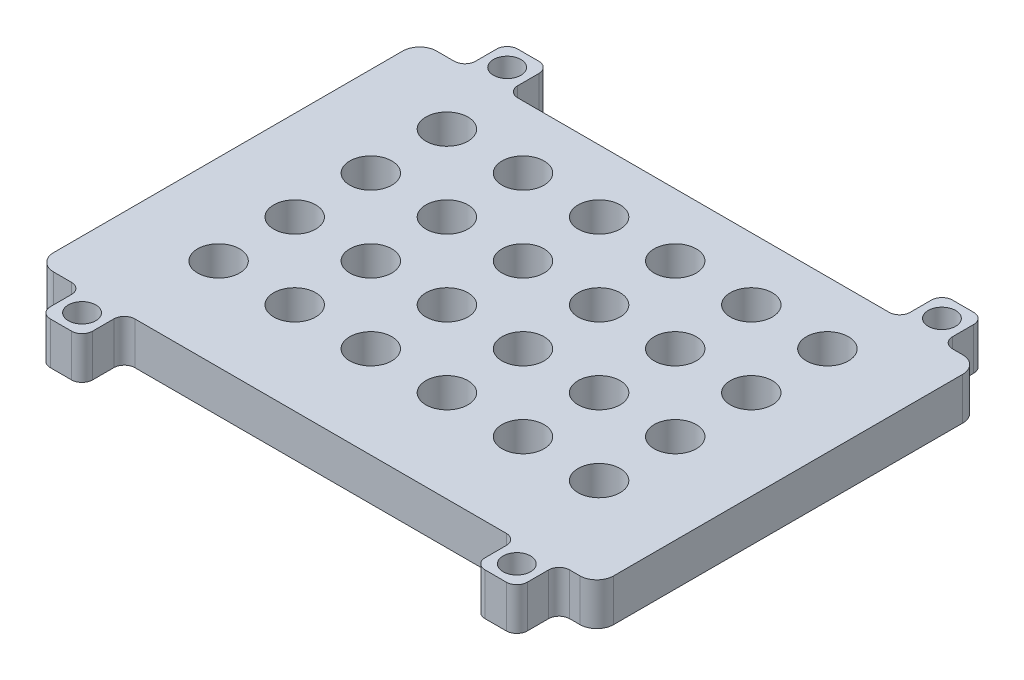
from build123d import *

# Parameters (mm, degrees)
SKETCH1_W           = 132.45
SKETCH1_H           = 90.551
SKETCH1_R           = 3.5
BOSS_EXTRUDE1_DEPTH = 10
SKETCH3_W           = 10
SKETCH3_H           = 10
BOSS_EXTRUDE3_DEPTH = 10
SKETCH4_R           = 3.25
CUT_EXTRUDE2_DEPTH  = 87.839688652
FILLET2_R           = 2.5
FILLET3_R           = 4
SKETCH5_R           = 4.975
CUT_EXTRUDE3_DEPTH  = 9.5


with BuildPart() as part:
    # Sketch1 → Boss-Extrude1 (new body)
    with BuildSketch(Plane(origin=(0, 0, 0), x_dir=(1, 0, 0), z_dir=(0, 1, 0))):
        Rectangle(SKETCH1_W, SKETCH1_H)
        with Locations(Location((-45, 30.5, 0), (0, 0, 270))):
            Circle(SKETCH1_R, mode=Mode.SUBTRACT)
        with Locations(Location((-27, 30.5, 0), (0, 0, 270))):
            Circle(SKETCH1_R, mode=Mode.SUBTRACT)
        with Locations(Location((-9, 30.5, 0), (0, 0, 270))):
            Circle(SKETCH1_R, mode=Mode.SUBTRACT)
        with Locations(Location((9, 30.5, 0), (0, 0, 270))):
            Circle(SKETCH1_R, mode=Mode.SUBTRACT)
        with Locations(Location((27, 30.5, 0), (0, 0, 270))):
            Circle(SKETCH1_R, mode=Mode.SUBTRACT)
        with Locations(Location((45, 30.5, 0), (0, 0, 270))):
            Circle(SKETCH1_R, mode=Mode.SUBTRACT)
        with Locations(Location((-27, 12.5, 0), (0, 0, 270))):
            Circle(SKETCH1_R, mode=Mode.SUBTRACT)
        with Locations(Location((-9, 12.5, 0), (0, 0, 270))):
            Circle(SKETCH1_R, mode=Mode.SUBTRACT)
        with Locations(Location((9, 12.5, 0), (0, 0, 270))):
            Circle(SKETCH1_R, mode=Mode.SUBTRACT)
        with Locations(Location((27, 12.5, 0), (0, 0, 270))):
            Circle(SKETCH1_R, mode=Mode.SUBTRACT)
        with Locations(Location((45, 12.5, 0), (0, 0, 270))):
            Circle(SKETCH1_R, mode=Mode.SUBTRACT)
        with Locations(Location((-27, -5.5, 0), (0, 0, 270))):
            Circle(SKETCH1_R, mode=Mode.SUBTRACT)
        with Locations(Location((-9, -5.5, 0), (0, 0, 270))):
            Circle(SKETCH1_R, mode=Mode.SUBTRACT)
        with Locations(Location((9, -5.5, 0), (0, 0, 270))):
            Circle(SKETCH1_R, mode=Mode.SUBTRACT)
        with Locations(Location((27, -5.5, 0), (0, 0, 270))):
            Circle(SKETCH1_R, mode=Mode.SUBTRACT)
        with Locations(Location((45, -5.5, 0), (0, 0, 270))):
            Circle(SKETCH1_R, mode=Mode.SUBTRACT)
        with Locations(Location((-27, -23.5, 0), (0, 0, 270))):
            Circle(SKETCH1_R, mode=Mode.SUBTRACT)
        with Locations(Location((-9, -23.5, 0), (0, 0, 270))):
            Circle(SKETCH1_R, mode=Mode.SUBTRACT)
        with Locations(Location((9, -23.5, 0), (0, 0, 270))):
            Circle(SKETCH1_R, mode=Mode.SUBTRACT)
        with Locations(Location((27, -23.5, 0), (0, 0, 270))):
            Circle(SKETCH1_R, mode=Mode.SUBTRACT)
        with Locations(Location((45, -23.5, 0), (0, 0, 270))):
            Circle(SKETCH1_R, mode=Mode.SUBTRACT)
        with Locations(Location((-45, 12.5, 0), (0, 0, 270))):
            Circle(SKETCH1_R, mode=Mode.SUBTRACT)
        with Locations(Location((-45, -5.5, 0), (0, 0, 270))):
            Circle(SKETCH1_R, mode=Mode.SUBTRACT)
        with Locations(Location((-45, -23.5, 0), (0, 0, 270))):
            Circle(SKETCH1_R, mode=Mode.SUBTRACT)
    extrude(amount=BOSS_EXTRUDE1_DEPTH)

    # Sketch3 → Boss-Extrude3 (add)
    with BuildSketch(Plane.XZ):
        with Locations((52.3134, -50.2755)):
            Rectangle(SKETCH3_W, SKETCH3_H)
        with Locations((-50.5226, -50.2755)):
            Rectangle(SKETCH3_W, SKETCH3_H)
        with Locations((-50.5226, 50.2755)):
            Rectangle(SKETCH3_W, SKETCH3_H)
        with Locations((52.3134, 50.2755)):
            Rectangle(SKETCH3_W, SKETCH3_H)
    extrude(amount=-BOSS_EXTRUDE3_DEPTH)

    # Sketch4 → Cut-Extrude2 (cut, through all)
    with BuildSketch(Plane(origin=(0, 0, 0), x_dir=(-1, 0, 0), z_dir=(0, -1, 0))):
        with Locations(Location((-52.3134, -50.2755, 0), (0, 0, 90))):
            Circle(SKETCH4_R)
        with Locations(Location((50.5226, -50.2755, 0), (0, 0, 90))):
            Circle(SKETCH4_R)
        with Locations(Location((50.5226, 50.2755, 0), (0, 0, 90))):
            Circle(SKETCH4_R)
        with Locations(Location((-52.3134, 50.2755, 0), (0, 0, 90))):
            Circle(SKETCH4_R)
    extrude(amount=-CUT_EXTRUDE2_DEPTH, mode=Mode.SUBTRACT)

    # Fillet2
    fillet2_edges = [part.edges().sort_by_distance(p)[0] for p in [
        (47.3134, 5, 55.2755),
        (47.3134, 5, 45.2755),
        (57.3134, 5, 55.2755),
        (57.3134, 5, 45.2755),
        (-45.5226, 5, 55.2755),
        (-45.5226, 5, 45.2755),
        (-55.5226, 5, 55.2755),
        (-55.5226, 5, 45.2755),
        (-45.5226, 5, -45.2755),
        (-45.5226, 5, -55.2755),
        (-55.5226, 5, -45.2755),
        (-55.5226, 5, -55.2755),
        (47.3134, 5, -45.2755),
        (47.3134, 5, -55.2755),
        (57.3134, 5, -45.2755),
        (57.3134, 5, -55.2755),
    ]]
    fillet(fillet2_edges, radius=FILLET2_R)

    # Fillet3
    fillet3_edges = [part.edges().sort_by_distance(p)[0] for p in [
        (-66.225, 5, -45.2755),
        (-66.225, 5, 45.2755),
        (66.225, 5, 45.2755),
        (66.225, 5, -45.2755),
    ]]
    fillet(fillet3_edges, radius=FILLET3_R)

    # Sketch5 → Cut-Extrude3 (cut)
    with BuildSketch(Plane(origin=(0, 10, 0), x_dir=(1, 0, 0), z_dir=(0, 1, 0))):
        with Locations(Location((45, -23.5, 0), (0, 0, 270))):
            Circle(SKETCH5_R)
        with Locations(Location((27, -23.5, 0), (0, 0, 270))):
            Circle(SKETCH5_R)
        with Locations(Location((9, -23.5, 0), (0, 0, 270))):
            Circle(SKETCH5_R)
        with Locations(Location((-9, -23.5, 0), (0, 0, 270))):
            Circle(SKETCH5_R)
        with Locations(Location((-27, -23.5, 0), (0, 0, 270))):
            Circle(SKETCH5_R)
        with Locations(Location((-45, -23.5, 0), (0, 0, 270))):
            Circle(SKETCH5_R)
        with Locations(Location((45, -5.5, 0), (0, 0, 270))):
            Circle(SKETCH5_R)
        with Locations(Location((27, -5.5, 0), (0, 0, 270))):
            Circle(SKETCH5_R)
        with Locations(Location((9, -5.5, 0), (0, 0, 270))):
            Circle(SKETCH5_R)
        with Locations(Location((-9, -5.5, 0), (0, 0, 270))):
            Circle(SKETCH5_R)
        with Locations(Location((-27, -5.5, 0), (0, 0, 270))):
            Circle(SKETCH5_R)
        with Locations(Location((-45, -5.5, 0), (0, 0, 270))):
            Circle(SKETCH5_R)
        with Locations(Location((45, 12.5, 0), (0, 0, 270))):
            Circle(SKETCH5_R)
        with Locations(Location((27, 12.5, 0), (0, 0, 270))):
            Circle(SKETCH5_R)
        with Locations(Location((9, 12.5, 0), (0, 0, 270))):
            Circle(SKETCH5_R)
        with Locations(Location((-9, 12.5, 0), (0, 0, 270))):
            Circle(SKETCH5_R)
        with Locations(Location((-27, 12.5, 0), (0, 0, 270))):
            Circle(SKETCH5_R)
        with Locations(Location((-45, 12.5, 0), (0, 0, 270))):
            Circle(SKETCH5_R)
        with Locations(Location((45, 30.5, 0), (0, 0, 270))):
            Circle(SKETCH5_R)
        with Locations(Location((27, 30.5, 0), (0, 0, 270))):
            Circle(SKETCH5_R)
        with Locations(Location((9, 30.5, 0), (0, 0, 270))):
            Circle(SKETCH5_R)
        with Locations(Location((-9, 30.5, 0), (0, 0, 270))):
            Circle(SKETCH5_R)
        with Locations(Location((-27, 30.5, 0), (0, 0, 270))):
            Circle(SKETCH5_R)
        with Locations(Location((-45, 30.5, 0), (0, 0, 270))):
            Circle(SKETCH5_R)
    extrude(amount=-CUT_EXTRUDE3_DEPTH, mode=Mode.SUBTRACT)


solid = part.part
